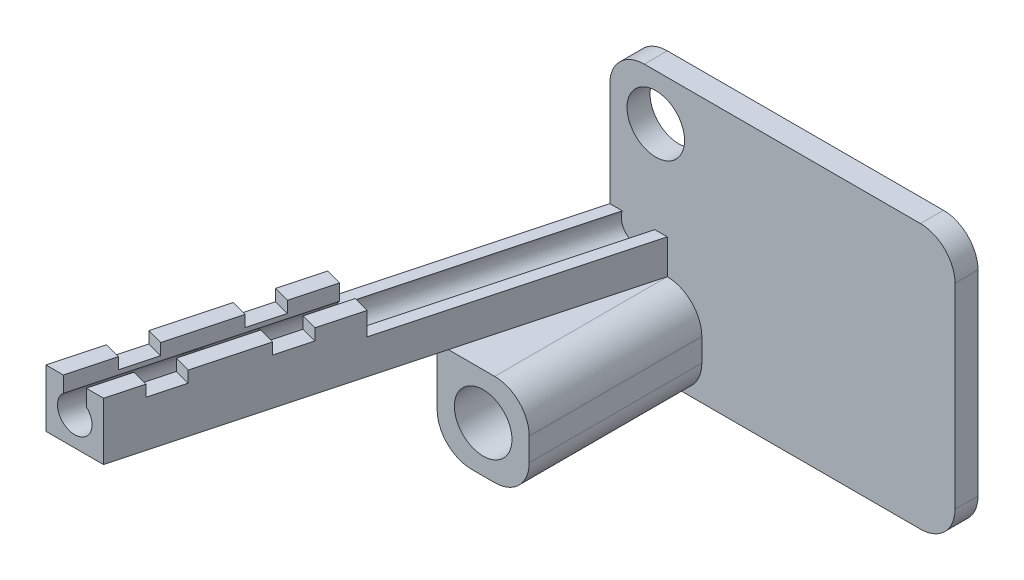
from build123d import *

# Parameters (mm, degrees)
CROQUIS3_W              = 30
CROQUIS3_H              = 23
CROQUIS3_R              = 2.5
SALIENTE_EXTRUIR2_DEPTH = 2
CROQUIS5_W              = 8
CROQUIS5_H              = 8
CROQUIS5_R              = 2.5
SALIENTE_EXTRUIR3_DEPTH = 15
SALIENTE_EXTRUIR4_DEPTH = 40
REDONDEO1_R             = 3
CORTAR_EXTRUIR2_DEPTH   = 2
CORTAR_EXTRUIR3_DEPTH   = 1


with BuildPart() as part:
    # Croquis3 → Saliente-Extruir2 (new body)
    with BuildSketch(Plane.XY):
        with Locations((-48.169014085, 19.436619718)):
            Rectangle(CROQUIS3_W, CROQUIS3_H)
        with Locations((-59.169014085, 26.936619718)):
            Circle(CROQUIS3_R, mode=Mode.SUBTRACT)
        with Locations(Location((-59.169014085, 11.936619718, 0), (0, 0, 180))):
            Circle(CROQUIS3_R, mode=Mode.SUBTRACT)
    extrude(amount=SALIENTE_EXTRUIR2_DEPTH)

    # Croquis5 → Saliente-Extruir3 (add)
    with BuildSketch(Plane.XY.offset(2)):
        with Locations((-59.169014085, 11.936619718)):
            Rectangle(CROQUIS5_W, CROQUIS5_H)
        with Locations(Location((-59.169014085, 11.936619718, 0), (0, 0, 180))):
            Circle(CROQUIS5_R, mode=Mode.SUBTRACT)
    extrude(amount=SALIENTE_EXTRUIR3_DEPTH)

    # Croquis6 → Saliente-Extruir4 (add, along a direction that is not the sketch's normal)
    with BuildSketch(Plane.XY.offset(2)):
        with BuildLine():
            Line((-63.169014085, 15.936619718), (-58.169014085, 15.936619718))
            Line((-58.169014085, 15.936619718), (-58.169014085, 20.936619718))
            Line((-58.169014085, 20.936619718), (-59.669014085, 20.936619718))
            Line((-59.669014085, 20.936619718), (-59.669014085, 19.554653707))
            ThreePointArc((-59.669014085, 19.554653707), (-60.669014085, 16.936619718), (-61.669014085, 19.554653707))
            Line((-61.669014085, 19.554653707), (-61.669014085, 20.936619718))
            Line((-61.669014085, 20.936619718), (-63.169014085, 20.936619718))
            Line((-63.169014085, 20.936619718), (-63.169014085, 15.936619718))
        make_face()
    extrude(amount=SALIENTE_EXTRUIR4_DEPTH, dir=(-0.2588190451025139, 0, 0.9659258262890701))

    # Redondeo1
    redondeo1_edges = [part.edges().sort_by_distance(p)[0] for p in [
        (-33.169014085, 7.936619718, 1),
        (-33.169014085, 30.936619718, 1),
        (-63.169014085, 7.936619718, 8.5),
        (-63.169014085, 30.936619718, 1),
        (-55.169014085, 7.936619718, 9.5),
        (-55.169014085, 15.936619718, 9.5),
    ]]
    fillet(redondeo1_edges, radius=REDONDEO1_R)

    # Croquis10 → Cortar-Extruir2 (cut)
    with BuildSketch(Plane(origin=(0, 20.936619718, 0), x_dir=(1, 0, 0), z_dir=(0, 1, 0))):
        Polygon((-58.169014085, -2), (-63.169014085, -2), (-68.345394987, -21.318516526), (-63.680331477, -22.568516526), align=None)
    extrude(amount=-CORTAR_EXTRUIR2_DEPTH, mode=Mode.SUBTRACT)

    # Croquis11 → Cortar-Extruir3 (cut)
    with BuildSketch(Plane(origin=(0, 20.936619718, 0), x_dir=(1, 0, 0), z_dir=(0, 1, 0))):
        Polygon((-64.639490212, -26.148145657), (-69.304553722, -24.898145657), (-70.081010857, -27.795923136), (-65.415947347, -29.045923136), align=None)
        Polygon((-66.968861618, -34.841478094), (-71.633925127, -33.591478094), (-72.410382263, -36.489255573), (-67.745318753, -37.739255573), align=None)
    extrude(amount=-CORTAR_EXTRUIR3_DEPTH, mode=Mode.SUBTRACT)


solid = part.part
